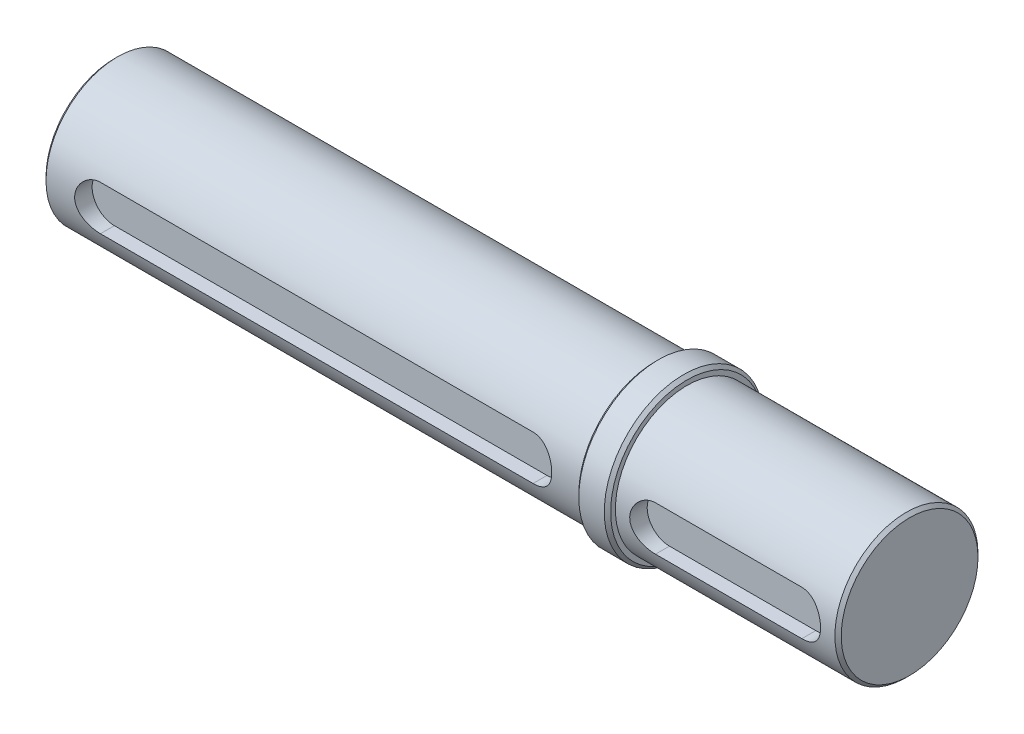
from build123d import *

# Parameters (mm, degrees)
HOLE_WIZARD_M101_D     = 8.5
HOLE_WIZARD_M101_DEPTH = 52.5
HOLE_WIZARD_M101_TIP   = 2.553657631
CHAMFER_1_SIZE         = 1
CUT_EXTRUDE_START      = 22.5
CUT_EXTRUDE_1_DEPTH    = 5.5
CUT_EXTRUDE_2_DEPTH    = 5.5


with BuildPart() as part:
    # Эскиз1 → Повернуть1 (revolve)
    with BuildSketch(Plane.XY, mode=Mode.PRIVATE) as revolve_1_sk:
        Polygon((0, 0), (0, 22.5), (170, 22.5), (170, 25), (180, 25), (180, 22.5), (250, 22.5), (250, 0), align=None)
    revolve(revolve_1_sk.sketch.rotate(Axis((0, 0, 0), (-1, 0, 0)), 90), axis=Axis((0, 0, 0), (-1, 0, 0)))

    # Отверстие обработанное метчиком M101
    with Locations(Plane.ZY):
        with Locations((0, 0)):
            Hole(HOLE_WIZARD_M101_D / 2, depth=HOLE_WIZARD_M101_DEPTH)
            with Locations((0, 0, -(HOLE_WIZARD_M101_DEPTH + HOLE_WIZARD_M101_TIP / 2))):  # 118° drill point
                Cone(0, HOLE_WIZARD_M101_D / 2, HOLE_WIZARD_M101_TIP, mode=Mode.SUBTRACT)

    # Фаска1
    chamfer_1_edges = [part.edges().sort_by_distance(p)[0] for p in [
        (250, 0, 22.5),
        (180, 0, 25),
        (170, 0, 25),
        (0, 0, 22.5),
    ]]
    chamfer(chamfer_1_edges, length=CHAMFER_1_SIZE)

    # Эскиз4 → Вырез-Вытянуть1 (cut)
    with BuildSketch(Plane.XY.offset(CUT_EXTRUDE_START)):
        with BuildLine():
            Line((237.5, -7), (191.5, -7))
            ThreePointArc((191.5, -7), (184.5, 0), (191.5, 7))
            Line((191.5, 7), (237.5, 7))
            ThreePointArc((237.5, 7), (244.5, 0), (237.5, -7))
        make_face()
    extrude(amount=-CUT_EXTRUDE_1_DEPTH, mode=Mode.SUBTRACT)

    # Эскиз5 → Вырез-Вытянуть2 (cut)
    with BuildSketch(Plane.XY.offset(CUT_EXTRUDE_START)):
        with BuildLine():
            Line((17, 7), (153, 7))
            ThreePointArc((153, 7), (160, 0), (153, -7))
            Line((153, -7), (17, -7))
            ThreePointArc((17, -7), (10, 0), (17, 7))
        make_face()
    extrude(amount=-CUT_EXTRUDE_2_DEPTH, mode=Mode.SUBTRACT)


solid = part.part
